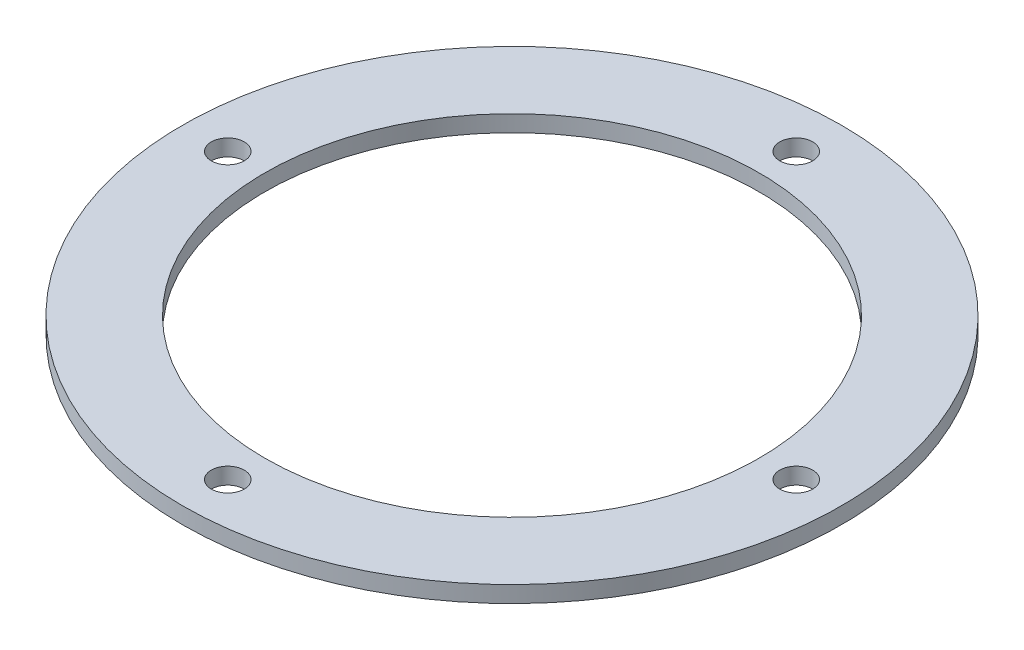
from build123d import *

# Parameters (mm, degrees)
SKETCH_2_R      = 40
SKETCH_2_R_2    = 30
SKETCH_2_R_3    = 2
EXTRUDE_1_DEPTH = 2


with BuildPart() as part:
    # 草图2 → 凸台-拉伸1 (new body)
    with BuildSketch(Plane(origin=(0, 0, 0), x_dir=(1, 0, 0), z_dir=(0, 1, 0))):
        with Locations(Location((0, 0, 0), (0, 0, 270))):
            Circle(SKETCH_2_R)
        with Locations(Location((0, 0, 0), (0, 0, 270))):
            Circle(SKETCH_2_R_2, mode=Mode.SUBTRACT)
        with Locations(Location((0, 34.5, 0), (0, 0, 270))):
            Circle(SKETCH_2_R_3, mode=Mode.SUBTRACT)
        with Locations(Location((34.5, 0, 0), (0, 0, 270))):
            Circle(SKETCH_2_R_3, mode=Mode.SUBTRACT)
        with Locations(Location((0, -34.5, 0), (0, 0, 270))):
            Circle(SKETCH_2_R_3, mode=Mode.SUBTRACT)
        with Locations(Location((-34.5, 0, 0), (0, 0, 270))):
            Circle(SKETCH_2_R_3, mode=Mode.SUBTRACT)
    extrude(amount=EXTRUDE_1_DEPTH)


solid = part.part
